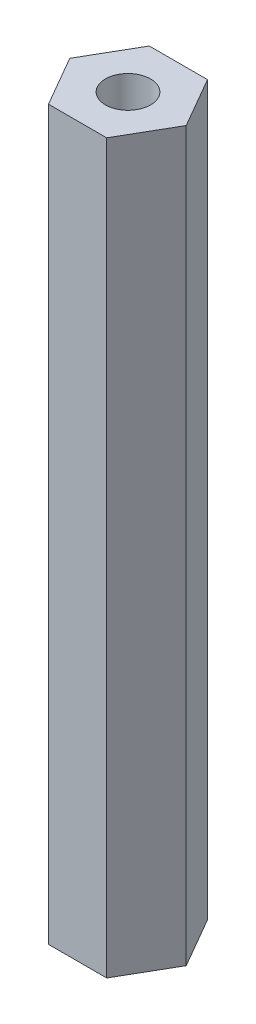
from build123d import *

# Parameters (mm, degrees)
SKETCH_1_R      = 1.55
EXTRUDE_1_DEPTH = 50


with BuildPart() as part:
    # 草圖1 → 填料-伸長1 (new body)
    with BuildSketch(Plane(origin=(0, 0, 0), x_dir=(1, 0, 0), z_dir=(0, 1, 0))):
        Polygon((2, 3.464101615), (-2, 3.464101615), (-4, 0), (-2, -3.464101615), (2, -3.464101615), (4, 0), align=None)
        with Locations(Location((0, 0, 0), (0, 0, 270))):
            Circle(SKETCH_1_R, mode=Mode.SUBTRACT)
    extrude(amount=EXTRUDE_1_DEPTH)


solid = part.part
